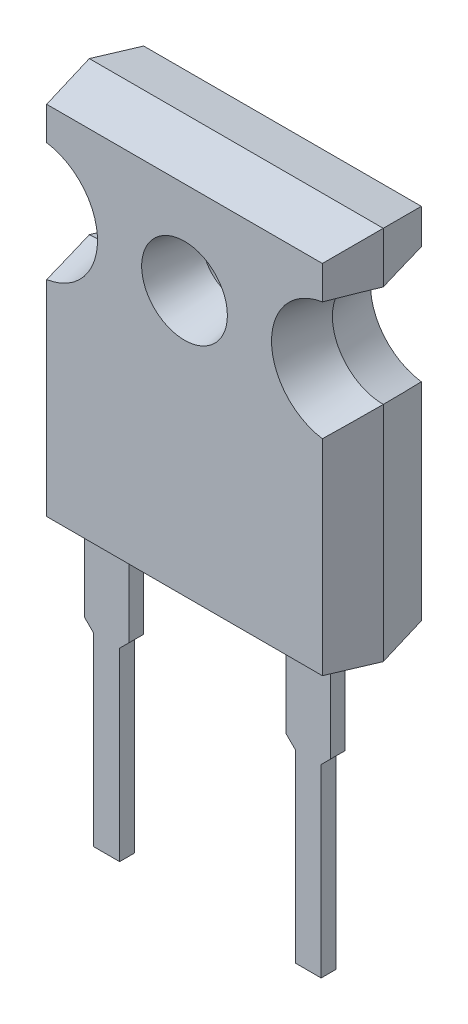
from build123d import *

# Parameters (mm, degrees)
ESBO_O1_R                          = 1.825
RESSALTO_EXTRUS_O1_DEPTH           = 2.8
RESSALTO_EXTRUS_O1_DRAFT           = 10
RESSALTO_EXTRUS_O1_OTHER_WAY_DEPTH = 2.5
RESSALTO_EXTRUS_O1_OTHER_WAY_DRAFT = -10
RESSALTO_EXTRUS_O2_DEPTH           = 0.8
PADR_O_LINEAR3_COUNT               = 2
PADR_O_LINEAR3_PITCH               = 10.9


with BuildPart() as part:
    # Esboço1 → Ressalto-extrusão1 (with draft: the straight prism first)
    with BuildSketch(Plane.XY):
        with BuildLine():
            Line((-24.066345061, -3.412919893), (-8.166345061, -3.412919893))
            Line((-8.166345061, -3.412919893), (-8.166345061, 8.637080107))
            ThreePointArc((-8.166345061, 8.637080107), (-10.916345061, 11.387080107), (-8.166345061, 14.137080107))
            Line((-8.166345061, 14.137080107), (-8.166345061, 16.887080107))
            Line((-8.166345061, 16.887080107), (-24.066345061, 16.887080107))
            Line((-24.066345061, 16.887080107), (-24.066345061, 14.137080107))
            ThreePointArc((-24.066345061, 14.137080107), (-21.316345061, 11.387080107), (-24.066345061, 8.637080107))
            Line((-24.066345061, 8.637080107), (-24.066345061, -3.412919893))
        make_face()
        with Locations((-16.116345061, 11.387080107)):
            Circle(ESBO_O1_R, mode=Mode.SUBTRACT)
    extrude(amount=RESSALTO_EXTRUS_O1_DEPTH)
    # Ressalto-extrusão1: the draft: its side faces are tilted about the plane it starts from
    ressalto_extrus_o1_sides = [part.faces().sort_by_distance(p)[0] for p in [
        (-24.066345061, 2.612080107, 1.4),
        (-16.116345061, -3.412919893, 1.4),
        (-8.166345061, 2.612080107, 1.4),
        (-10.916345061, 11.387080107, 1.4),
        (-8.166345061, 15.512080107, 1.4),
        (-16.116345061, 16.887080107, 1.4),
        (-24.066345061, 15.512080107, 1.4),
        (-21.316345061, 11.387080107, 1.4),
        (-17.941345061, 11.387080107, 1.4),
    ]]
    draft(ressalto_extrus_o1_sides, Plane.XY, RESSALTO_EXTRUS_O1_DRAFT)


with BuildPart() as ressalto_extrus_o1_other_way_tool:
    # Esboço1 → Ressalto-extrusão1 other way (with draft: the straight prism first)
    with BuildSketch(Plane.XY):
        with BuildLine():
            Line((-24.066345061, -3.412919893), (-8.166345061, -3.412919893))
            Line((-8.166345061, -3.412919893), (-8.166345061, 8.637080107))
            ThreePointArc((-8.166345061, 8.637080107), (-10.916345061, 11.387080107), (-8.166345061, 14.137080107))
            Line((-8.166345061, 14.137080107), (-8.166345061, 16.887080107))
            Line((-8.166345061, 16.887080107), (-24.066345061, 16.887080107))
            Line((-24.066345061, 16.887080107), (-24.066345061, 14.137080107))
            ThreePointArc((-24.066345061, 14.137080107), (-21.316345061, 11.387080107), (-24.066345061, 8.637080107))
            Line((-24.066345061, 8.637080107), (-24.066345061, -3.412919893))
        make_face()
        with Locations((-16.116345061, 11.387080107)):
            Circle(ESBO_O1_R, mode=Mode.SUBTRACT)
    extrude(amount=-RESSALTO_EXTRUS_O1_OTHER_WAY_DEPTH)
    # Ressalto-extrusão1 other way: the draft: its side faces are tilted about the plane it starts from
    ressalto_extrus_o1_other_way_sides = [ressalto_extrus_o1_other_way_tool.faces().sort_by_distance(p)[0] for p in [
        (-24.066345061, 2.612080107, -1.25),
        (-16.116345061, -3.412919893, -1.25),
        (-8.166345061, 2.612080107, -1.25),
        (-10.916345061, 11.387080107, -1.25),
        (-8.166345061, 15.512080107, -1.25),
        (-16.116345061, 16.887080107, -1.25),
        (-24.066345061, 15.512080107, -1.25),
        (-21.316345061, 11.387080107, -1.25),
        (-17.941345061, 11.387080107, -1.25),
    ]]
    draft(ressalto_extrus_o1_other_way_sides, Plane.XY, RESSALTO_EXTRUS_O1_OTHER_WAY_DRAFT)


with BuildPart() as part_1:
    add(part.part)

    # Ressalto-extrusão1 other way: add ressalto_extrus_o1_other_way_tool
    add(ressalto_extrus_o1_other_way_tool.part)


with BuildPart() as body_2:
    # Esboço2 → Ressalto-extrusão2 (new body)
    with BuildSketch(Plane(origin=(0, 0, 0.9), x_dir=(-1, 0, 0), z_dir=(0, 0, -1))):
        Polygon((22.626426453, -3.412919893), (20.226426453, -3.412919893), (20.226426453, -7.712919893), (20.726426453, -8.212919893), (20.726426453, -18.212919893), (22.126426453, -18.212919893), (22.126426453, -8.212919893), (22.626426453, -7.712919893), align=None)
    extrude(amount=-RESSALTO_EXTRUS_O2_DEPTH)


with BuildPart() as padr_o_linear3_1:
    # Padrão linear3: pattern copy
    add(body_2.part.moved(Location(Vector(1, 0, 0) * (1 * PADR_O_LINEAR3_PITCH))))


solid = Compound([part_1.part, body_2.part, padr_o_linear3_1.part])
